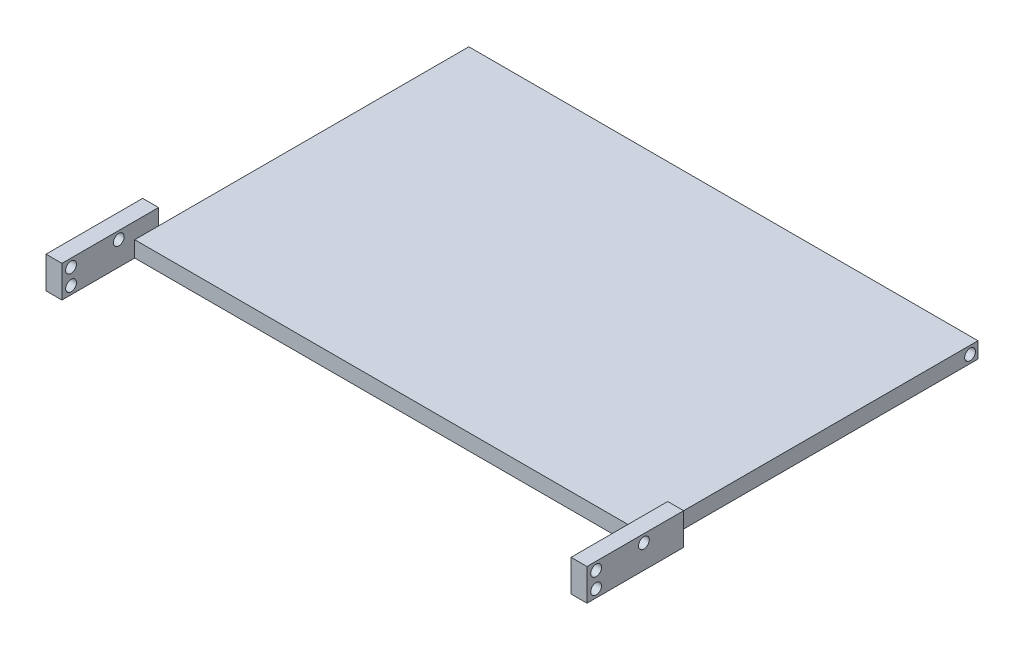
from build123d import *

# Parameters (mm, degrees)
SKETCH_1_W          = 160
SKETCH_1_H          = 105
EXTRUDE_1_DEPTH     = 5
SKETCH_3_W          = 30.377017425
SKETCH_3_H          = 10
EXTRUDE_3_DEPTH     = 5
SKETCH_4_W          = 30.377017425
SKETCH_4_H          = 10
EXTRUDE_4_DEPTH     = 5
SKETCH_5_R          = 1.7
CUT_EXTRUDE_1_DEPTH = 200
SKETCH_6_R          = 1.7
CUT_EXTRUDE_3_DEPTH = 200
SKETCH_7_R          = 1.7
CUT_EXTRUDE_4_DEPTH = 200


with BuildPart() as part:
    # 草图1 → 凸台-拉伸1 (new body)
    with BuildSketch(Plane(origin=(0, 0, 0), x_dir=(1, 0, 0), z_dir=(0, 1, 0))):
        Rectangle(SKETCH_1_W, SKETCH_1_H)
    extrude(amount=EXTRUDE_1_DEPTH)

    # 草图3 → 凸台-拉伸3 (add)
    with BuildSketch(Plane(origin=(80, 0, 0), x_dir=(0, 0, -1), z_dir=(1, 0, 0))):
        with Locations((-60.188508713, 5)):
            Rectangle(SKETCH_3_W, SKETCH_3_H)
    extrude(amount=EXTRUDE_3_DEPTH)

    # 草图4 → 凸台-拉伸4 (add)
    with BuildSketch(Plane.ZY.offset(80)):
        with Locations((60.188508713, 5)):
            Rectangle(SKETCH_4_W, SKETCH_4_H)
    extrude(amount=EXTRUDE_4_DEPTH)

    # 草图5 → 切除-拉伸1 (cut)
    with BuildSketch(Plane.ZY.offset(80)):
        with Locations((-50, 2.5)):
            Circle(SKETCH_5_R)
    extrude(amount=-CUT_EXTRUDE_1_DEPTH, mode=Mode.SUBTRACT)

    # 草图6 → 切除-拉伸3 (cut)
    with BuildSketch(Plane.ZY.offset(85)):
        with Locations((57.5, 7.5)):
            Circle(SKETCH_6_R)
        with Locations((72.5, 7.5)):
            Circle(SKETCH_6_R)
    extrude(amount=-CUT_EXTRUDE_3_DEPTH, mode=Mode.SUBTRACT)

    # 草图7 → 切除-拉伸4 (cut)
    with BuildSketch(Plane(origin=(85, 0, 0), x_dir=(0, 0, -1), z_dir=(1, 0, 0))):
        with Locations((-72.5, 2.5)):
            Circle(SKETCH_7_R)
    extrude(amount=-CUT_EXTRUDE_4_DEPTH, mode=Mode.SUBTRACT)


solid = part.part
